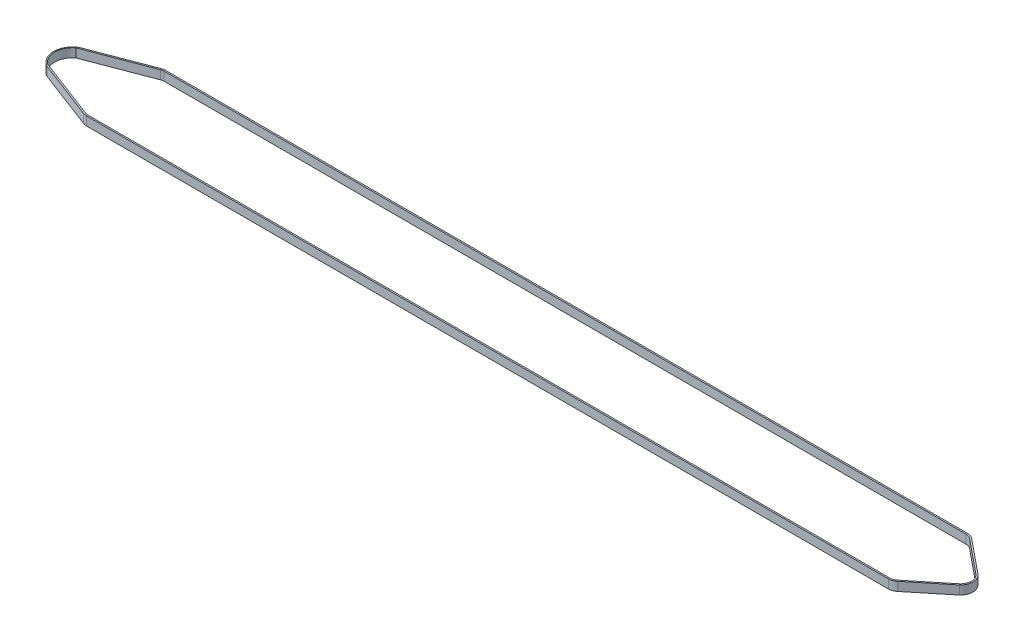
from build123d import *

# Parameters (mm, degrees)
DODANIE_WYCI_GNI_CIE1_DEPTH = 6


with BuildPart() as part:
    # Szkic1 → Dodanie-wyciągnięcie1 (new body)
    with BuildSketch(Plane(origin=(0, 0, 0), x_dir=(1, 0, 0), z_dir=(0, 1, 0))):
        with BuildLine():
            Line((-276.493755035, 26.54073282), (-317.199927227, 11.020878293))
            ThreePointArc((-317.199927227, 11.020878293), (-323.470347305, 0), (-317.199927227, -11.020878293))
            Line((-317.199927227, -11.020878293), (-276.493755035, -26.54073282))
            ThreePointArc((-276.493755035, -26.54073282), (-275.267846651, -26.8842258), (-274, -27))
            Line((-274, -27), (274, -27))
            ThreePointArc((274, -27), (276.508698973, -26.535015644), (278.68411058, -25.20183699))
            Line((278.68411058, -25.20183699), (301.877848562, -6.316516345))
            ThreePointArc((301.877848562, -6.316516345), (304.69, 0), (301.877848562, 6.316516345))
            Line((301.877848562, 6.316516345), (278.68411058, 25.20183699))
            ThreePointArc((278.68411058, 25.20183699), (276.508698973, 26.535015644), (274, 27))
            Line((274, 27), (-274, 27))
            ThreePointArc((-274, 27), (-275.267846651, 26.8842258), (-276.493755035, 26.54073282))
        make_face()
        with BuildLine():
            ThreePointArc((-318.031465247, 9.633625156), (-322.786422983, 0), (-318.031465247, -9.633625156))
            Line((-318.031465247, -9.633625156), (-276.137504316, -25.606342417))
            ThreePointArc((-276.137504316, -25.606342417), (-275.086725701, -25.900764972), (-274, -26))
            Line((-274, -26), (274, -26))
            ThreePointArc((274, -26), (276.150313405, -25.60144198), (278.014951926, -24.45871742))
            Line((278.014951926, -24.45871742), (301.208689908, -5.573396775))
            ThreePointArc((301.208689908, -5.573396775), (303.69, 0), (301.208689908, 5.573396775))
            Line((301.208689908, 5.573396775), (278.014951926, 24.45871742))
            ThreePointArc((278.014951926, 24.45871742), (276.150313405, 25.60144198), (274, 26))
            Line((274, 26), (-274, 26))
            ThreePointArc((-274, 26), (-275.086725701, 25.900764972), (-276.137504316, 25.606342417))
            Line((-276.137504316, 25.606342417), (-318.031465247, 9.633625156))
        make_face(mode=Mode.SUBTRACT)
    extrude(amount=DODANIE_WYCI_GNI_CIE1_DEPTH)


solid = part.part
